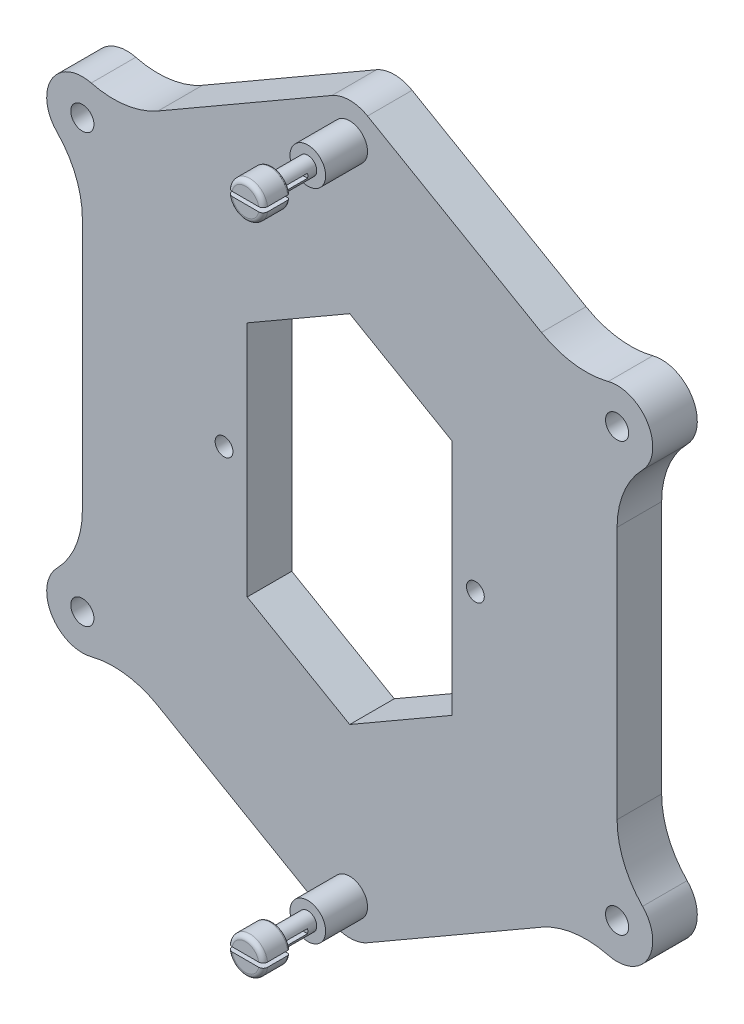
from build123d import *

# Parameters (mm, degrees)
BOSS_EXTRUDE1_DEPTH            = 5
SKETCH2_R                      = 2
BOSS_EXTRUDE2_DEPTH            = 11.7
CUT_EXTRUDE1_REACH             = 69.431
SKETCH3_R                      = 1.3
FILLET1_R                      = 10
FILLET3_R                      = 0.5
CUT_EXTRUDE4_REACH             = 69.431
CUT_EXTRUDE5_REACH             = 69.431
SKETCH10_R                     = 1
SKETCH20_W                     = 1
SKETCH20_H                     = 4
CUT_EXTRUDE6_REACH             = 57.632
SKETCH21_W                     = 0.5
SKETCH21_H                     = 6
CUT_EXTRUDE6_DIRECTION_2_REACH = 57.632
SKETCH24_W                     = 1
SKETCH24_H                     = 4
CUT_EXTRUDE7_REACH             = 57.632
SKETCH25_W                     = 0.5
SKETCH25_H                     = 6
CUT_EXTRUDE7_DIRECTION_2_REACH = 57.632
FILLET4_R                      = 0.25


with BuildPart() as part:
    # Sketch1 → Boss-Extrude1 (new body)
    with BuildSketch(Plane(origin=(0, 0, 0), x_dir=(0, 1, 0), z_dir=(0, 0, 1))):
        with BuildLine():
            Line((26.041464511, 8.094840945), (40.207272049, -16.44105744))
            ThreePointArc((40.207272049, -16.44105744), (40.743170434, -18.44105744), (40.207272049, -20.44105744))
            Line((40.207272049, -20.44105744), (26.041464511, -44.976955825))
            ThreePointArc((26.041464511, -44.976955825), (26.041464511, -51.905159055), (20.041464511, -48.44105744))
            Line((20.041464511, -48.44105744), (-19.958535489, -48.44105744))
            ThreePointArc((-19.958535489, -48.44105744), (-25.958535489, -51.905159055), (-25.958535489, -44.976955825))
            Line((-25.958535489, -44.976955825), (-40.124343026, -20.44105744))
            ThreePointArc((-40.124343026, -20.44105744), (-40.660241411, -18.44105744), (-40.124343026, -16.44105744))
            Line((-40.124343026, -16.44105744), (-25.958535489, 8.094840945))
            ThreePointArc((-25.958535489, 8.094840945), (-25.958535489, 15.023044175), (-19.958535489, 11.55894256))
            Line((-19.958535489, 11.55894256), (20.041464511, 11.55894256))
            ThreePointArc((20.041464511, 11.55894256), (26.041464511, 15.023044175), (26.041464511, 8.094840945))
        make_face()
    extrude(amount=BOSS_EXTRUDE1_DEPTH)

    # Sketch2 → Boss-Extrude2 (add)
    with BuildSketch(Plane.XY.offset(5)):
        with Locations((18.44105744, -36.660241411)):
            Circle(SKETCH2_R)
        with Locations(Location((18.44105744, 36.743170434, 0), (0, 0, 180))):
            Circle(SKETCH2_R)
    extrude(amount=BOSS_EXTRUDE2_DEPTH)

    # Sketch3 → Cut-Extrude1 (cut, up to next)
    with BuildSketch(Plane.XY.offset(5), mode=Mode.PRIVATE) as cut_extrude1_sk1:
        with Locations((-11.55894256, 24.041464511)):
            Circle(SKETCH3_R)
    cut_extrude1_tool1 = extrude(cut_extrude1_sk1.sketch, amount=-CUT_EXTRUDE1_REACH, mode=Mode.PRIVATE) & part.part
    # Sketch3 → Cut-Extrude1 (cut, up to next)
    with BuildSketch(Plane.XY.offset(5), mode=Mode.PRIVATE) as cut_extrude1_sk2:
        with Locations((48.44105744, 24.041464511)):
            Circle(SKETCH3_R)
    cut_extrude1_tool2 = extrude(cut_extrude1_sk2.sketch, amount=-CUT_EXTRUDE1_REACH, mode=Mode.PRIVATE) & part.part
    # Sketch3 → Cut-Extrude1 (cut, up to next)
    with BuildSketch(Plane.XY.offset(5), mode=Mode.PRIVATE) as cut_extrude1_sk3:
        with Locations((48.44105744, -23.958535489)):
            Circle(SKETCH3_R)
    cut_extrude1_tool3 = extrude(cut_extrude1_sk3.sketch, amount=-CUT_EXTRUDE1_REACH, mode=Mode.PRIVATE) & part.part
    # Sketch3 → Cut-Extrude1 (cut, up to next)
    with BuildSketch(Plane.XY.offset(5), mode=Mode.PRIVATE) as cut_extrude1_sk4:
        with Locations((-11.55894256, -23.958535489)):
            Circle(SKETCH3_R)
    cut_extrude1_tool4 = extrude(cut_extrude1_sk4.sketch, amount=-CUT_EXTRUDE1_REACH, mode=Mode.PRIVATE) & part.part
    add(cut_extrude1_tool1.solids().sort_by_distance((-11.558943, 24.041465, 5))[0], mode=Mode.SUBTRACT)
    add(cut_extrude1_tool2.solids().sort_by_distance((48.441057, 24.041465, 5))[0], mode=Mode.SUBTRACT)
    add(cut_extrude1_tool3.solids().sort_by_distance((48.441057, -23.958535, 5))[0], mode=Mode.SUBTRACT)
    add(cut_extrude1_tool4.solids().sort_by_distance((-11.558943, -23.958535, 5))[0], mode=Mode.SUBTRACT)

    # Fillet1
    fillet1_edges = [part.edges().sort_by_distance(p)[0] for p in [
        (44.976955825, -25.958535489, 2.5),
        (-8.094840945, -25.958535489, 2.5),
        (-11.55894256, -19.958535489, 2.5),
        (-11.55894256, 20.041464511, 2.5),
        (-8.094840945, 26.041464511, 2.5),
        (44.976955825, 26.041464511, 2.5),
        (48.44105744, 20.041464511, 2.5),
        (48.44105744, -19.958535489, 2.5),
    ]]
    fillet(fillet1_edges, radius=FILLET1_R)

    # Fillet3
    fillet3_edges = [part.edges().sort_by_distance(p)[0] for p in [
        (16.44105744, -36.660241411, 16.7),
        (20.44105744, 36.743170434, 16.7),
    ]]
    fillet(fillet3_edges, radius=FILLET3_R)

    # Sketch9 → Cut-Extrude4 (cut, up to next)
    with BuildSketch(Plane.XY.offset(5), mode=Mode.PRIVATE) as cut_extrude4_sk1:
        Polygon((18.44105744, -19.917083604), (29.94105744, -13.277555509), (29.94105744, 13.360484531), (18.44105744, 20.000012627), (6.94105744, 13.360484531), (6.94105744, -13.277555509), align=None)
    cut_extrude4_tool1 = extrude(cut_extrude4_sk1.sketch, amount=-CUT_EXTRUDE4_REACH, mode=Mode.PRIVATE) & part.part
    add(cut_extrude4_tool1.solids().sort_by_distance((18.441057, 0.041465, 5))[0], mode=Mode.SUBTRACT)

    # Sketch10 → Cut-Extrude5 (cut, up to next)
    with BuildSketch(Plane.XY.offset(5), mode=Mode.PRIVATE) as cut_extrude5_sk1:
        with Locations((4.34105744, 0.041464511)):
            Circle(SKETCH10_R)
    cut_extrude5_tool1 = extrude(cut_extrude5_sk1.sketch, amount=-CUT_EXTRUDE5_REACH, mode=Mode.PRIVATE) & part.part
    # Sketch10 → Cut-Extrude5 (cut, up to next)
    with BuildSketch(Plane.XY.offset(5), mode=Mode.PRIVATE) as cut_extrude5_sk2:
        with Locations((32.54105744, 0.041464511)):
            Circle(SKETCH10_R)
    cut_extrude5_tool2 = extrude(cut_extrude5_sk2.sketch, amount=-CUT_EXTRUDE5_REACH, mode=Mode.PRIVATE) & part.part
    add(cut_extrude5_tool1.solids().sort_by_distance((4.341057, 0.041465, 5))[0], mode=Mode.SUBTRACT)
    add(cut_extrude5_tool2.solids().sort_by_distance((32.541057, 0.041465, 5))[0], mode=Mode.SUBTRACT)

    # Sketch20 → Cut-Revolve1 (revolve, cut)
    with BuildSketch(Plane.YZ.offset(18.44105744), mode=Mode.PRIVATE) as cut_revolve1_sk:
        with Locations((38.243170434, 11.7)):
            Rectangle(SKETCH20_W, SKETCH20_H)
    revolve(cut_revolve1_sk.sketch.rotate(Axis((18.44105744, 36.743170434, 16.7), (0, 0, -1)), 270), axis=Axis((18.44105744, 36.743170434, 16.7), (0, 0, -1)), mode=Mode.SUBTRACT)

    # Sketch21 → Cut-Extrude6 (cut, up to next)
    with BuildSketch(Plane.YZ.offset(18.44105744), mode=Mode.PRIVATE) as cut_extrude6_sk1:
        with Locations((36.743170434, 13.7)):
            Rectangle(SKETCH21_W, SKETCH21_H)
    cut_extrude6_tool1 = extrude(cut_extrude6_sk1.sketch, amount=-CUT_EXTRUDE6_REACH, mode=Mode.PRIVATE) & part.part
    add(cut_extrude6_tool1.solids().sort_by_distance((18.441057, 36.74317, 13.7))[0], mode=Mode.SUBTRACT)

    # Sketch21 → Cut-Extrude6 direction 2 (cut, up to next)
    with BuildSketch(Plane.YZ.offset(18.44105744), mode=Mode.PRIVATE) as cut_extrude6_direction_2_sk1:
        with Locations((36.743170434, 13.7)):
            Rectangle(SKETCH21_W, SKETCH21_H)
    cut_extrude6_direction_2_tool1 = extrude(cut_extrude6_direction_2_sk1.sketch, amount=CUT_EXTRUDE6_DIRECTION_2_REACH, mode=Mode.PRIVATE) & part.part
    add(cut_extrude6_direction_2_tool1.solids().sort_by_distance((18.441057, 36.74317, 13.7))[0], mode=Mode.SUBTRACT)

    # Sketch24 → Cut-Revolve2 (revolve, cut)
    with BuildSketch(Plane.YZ.offset(18.44105744), mode=Mode.PRIVATE) as cut_revolve2_sk:
        with Locations((-38.160241411, 11.7)):
            Rectangle(SKETCH24_W, SKETCH24_H)
    revolve(cut_revolve2_sk.sketch.rotate(Axis((18.44105744, -36.660241411, 16.7), (0, 0, -1)), 270), axis=Axis((18.44105744, -36.660241411, 16.7), (0, 0, -1)), mode=Mode.SUBTRACT)

    # Sketch25 → Cut-Extrude7 (cut, up to next)
    with BuildSketch(Plane.YZ.offset(18.44105744), mode=Mode.PRIVATE) as cut_extrude7_sk1:
        with Locations((-36.660241411, 13.7)):
            Rectangle(SKETCH25_W, SKETCH25_H)
    cut_extrude7_tool1 = extrude(cut_extrude7_sk1.sketch, amount=-CUT_EXTRUDE7_REACH, mode=Mode.PRIVATE) & part.part
    add(cut_extrude7_tool1.solids().sort_by_distance((18.441057, -36.660241, 13.7))[0], mode=Mode.SUBTRACT)

    # Sketch25 → Cut-Extrude7 direction 2 (cut, up to next)
    with BuildSketch(Plane.YZ.offset(18.44105744), mode=Mode.PRIVATE) as cut_extrude7_direction_2_sk1:
        with Locations((-36.660241411, 13.7)):
            Rectangle(SKETCH25_W, SKETCH25_H)
    cut_extrude7_direction_2_tool1 = extrude(cut_extrude7_direction_2_sk1.sketch, amount=CUT_EXTRUDE7_DIRECTION_2_REACH, mode=Mode.PRIVATE) & part.part
    add(cut_extrude7_direction_2_tool1.solids().sort_by_distance((18.441057, -36.660241, 13.7))[0], mode=Mode.SUBTRACT)

    # Fillet4
    fillet4_edges = [part.edges().sort_by_distance(p)[0] for p in [
        (18.44105744, 38.743170434, 13.7),
        (18.44105744, 34.743170434, 13.7),
        (18.44105744, -34.660241411, 13.7),
        (18.44105744, -38.660241411, 13.7),
    ]]
    fillet(fillet4_edges, radius=FILLET4_R)


solid = part.part
